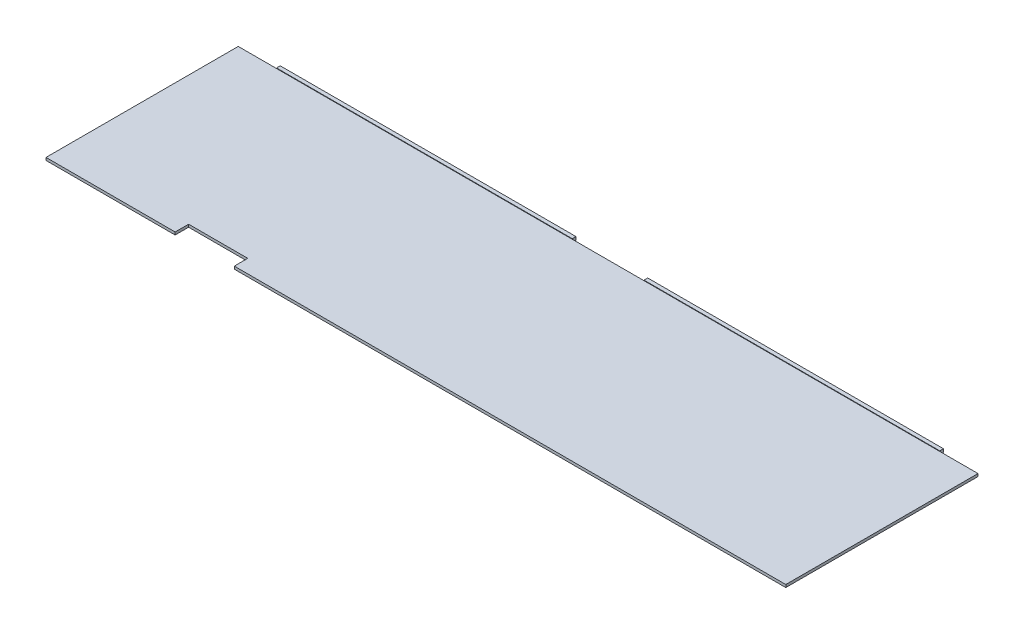
from build123d import *

# Parameters (mm, degrees)
SKETCH1_W           = 635.3556
SKETCH1_H           = 165.1
BOSS_EXTRUDE1_DEPTH = 1.143
SKETCH2_W           = 254
SKETCH2_H           = 2.7305
BOSS_EXTRUDE2_DEPTH = 3.175
SKETCH3_W           = 50.8
SKETCH3_H           = 11.194977228
SKETCH3_H_2         = 11.572519195
CUT_EXTRUDE1_DEPTH  = 330.052299594


with BuildPart() as part:
    # Sketch1 → Boss-Extrude1 (new, symmetric)
    with BuildSketch(Plane(origin=(0, 0, 0), x_dir=(1, 0, 0), z_dir=(0, 1, 0))):
        Rectangle(SKETCH1_W, SKETCH1_H)
    extrude(amount=BOSS_EXTRUDE1_DEPTH, both=True)

    # Sketch2 → Boss-Extrude2 (add)
    with BuildSketch(Plane(origin=(0, 0, -82.55), x_dir=(-1, 0, 0), z_dir=(0, 0, -1))):
        with Locations((-157.8229, 0.22225)):
            Rectangle(SKETCH2_W, SKETCH2_H)
        with Locations((157.8229, 0.22225)):
            Rectangle(SKETCH2_W, SKETCH2_H)
    extrude(amount=BOSS_EXTRUDE2_DEPTH)

    # Sketch3 → Cut-Extrude1 (cut, through all)
    with BuildSketch(Plane.XZ.offset(1.143)):
        with Locations((-181.370930865, 88.147488614)):
            Rectangle(SKETCH3_W, SKETCH3_H)
        with Locations((-181.370930865, 76.763740403)):
            Rectangle(SKETCH3_W, SKETCH3_H_2)
    extrude(amount=-CUT_EXTRUDE1_DEPTH, mode=Mode.SUBTRACT)


solid = part.part
